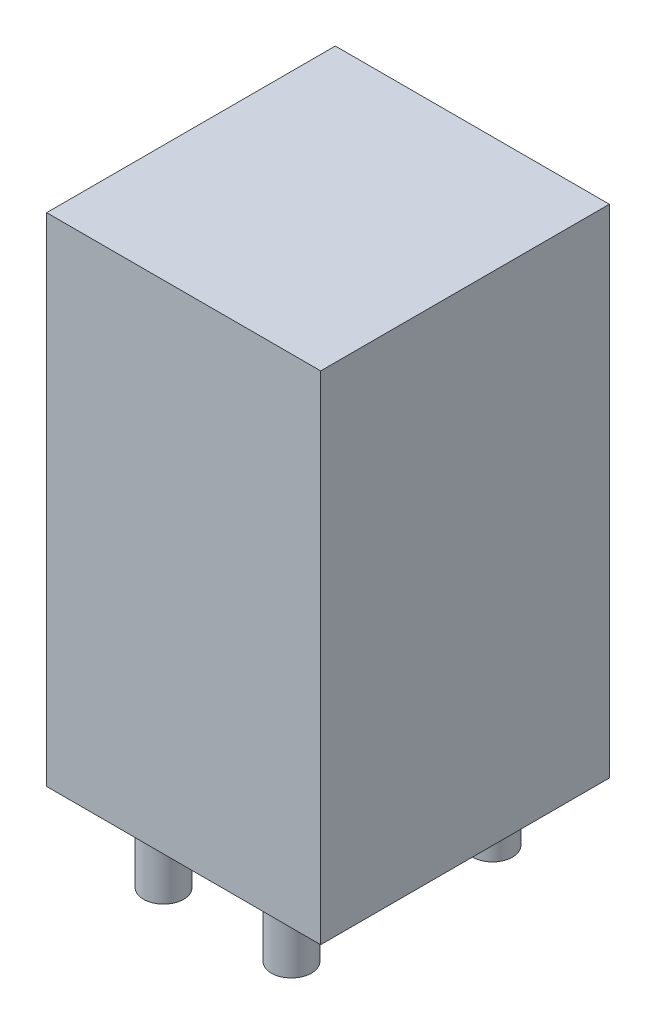
from build123d import *

# Parameters (mm, degrees)
SKETCH1_W           = 7.5
SKETCH1_H           = 7.9
BOSS_EXTRUDE1_DEPTH = 13.6
SKETCH2_R           = 0.55
BOSS_EXTRUDE2_DEPTH = 2


with BuildPart() as part:
    # Sketch1 → Boss-Extrude1 (new body)
    with BuildSketch(Plane(origin=(0, 0, 0), x_dir=(1, 0, 0), z_dir=(0, 1, 0))):
        with Locations((3.75, 3.95)):
            Rectangle(SKETCH1_W, SKETCH1_H)
    extrude(amount=BOSS_EXTRUDE1_DEPTH)

    # Sketch2 → Boss-Extrude2 (add)
    with BuildSketch(Plane(origin=(0, 0, 0), x_dir=(-1, 0, 0), z_dir=(0, -1, 0))):
        with Locations(Location((-2, 1.2, 0), (0, 0, 90))):
            Circle(SKETCH2_R)
        with Locations(Location((-2, 6.7, 0), (0, 0, 90))):
            Circle(SKETCH2_R)
        with Locations(Location((-5.5, 1.2, 0), (0, 0, 90))):
            Circle(SKETCH2_R)
        with Locations(Location((-5.5, 6.7, 0), (0, 0, 90))):
            Circle(SKETCH2_R)
    extrude(amount=BOSS_EXTRUDE2_DEPTH)


solid = part.part
